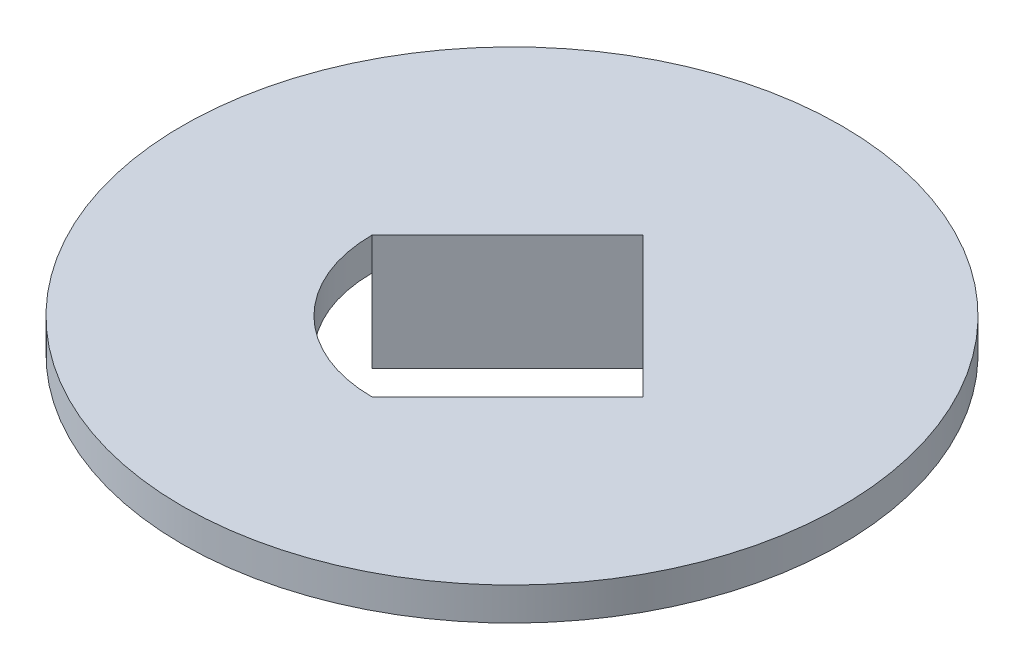
from build123d import *

# Parameters (mm, degrees)
SKETCH2_R           = 10
BOSS_EXTRUDE1_DEPTH = 1
BOSS_EXTRUDE2_DEPTH = 2.5
CUT_EXTRUDE1_START  = -2.5
CUT_EXTRUDE1_DEPTH  = 2.5


with BuildPart() as part:
    # Sketch2 → Boss-Extrude1 (new body)
    with BuildSketch(Plane(origin=(0, 0, 0), x_dir=(1, 0, 0), z_dir=(0, 1, 0))):
        with Locations(Location((0, 0, 0), (0, 0, 270))):
            Circle(SKETCH2_R)
    extrude(amount=BOSS_EXTRUDE1_DEPTH)

    # Sketch3 → Boss-Extrude2 (add)
    with BuildSketch(Plane.XZ):
        with BuildLine():
            Line((-4.25, 0), (-0.138270177, -4.111729823))
            Line((-0.138270177, -4.111729823), (4.119266685, 0.145807039))
            Line((4.119266685, 0.145807039), (0, 4.25))
            ThreePointArc((0, 4.25), (4.25, 0), (0, -4.25))
            ThreePointArc((0, -4.25), (-3.00520382, -3.00520382), (-4.25, 0))
        make_face()
    extrude(amount=BOSS_EXTRUDE2_DEPTH)

    # Sketch4 → Cut-Extrude1 (cut)
    with BuildSketch(Plane.XZ.offset(CUT_EXTRUDE1_START)):
        with BuildLine():
            Line((-0.138270177, -4.111729823), (4.119266685, 0.145807039))
            Line((4.119266685, 0.145807039), (0, 4.25))
            ThreePointArc((0, 4.25), (-3.00520382, 3.00520382), (-4.25, 0))
            Line((-4.25, 0), (-0.138270177, -4.111729823))
        make_face()
    extrude(amount=CUT_EXTRUDE1_DEPTH, mode=Mode.SUBTRACT)


solid = part.part
